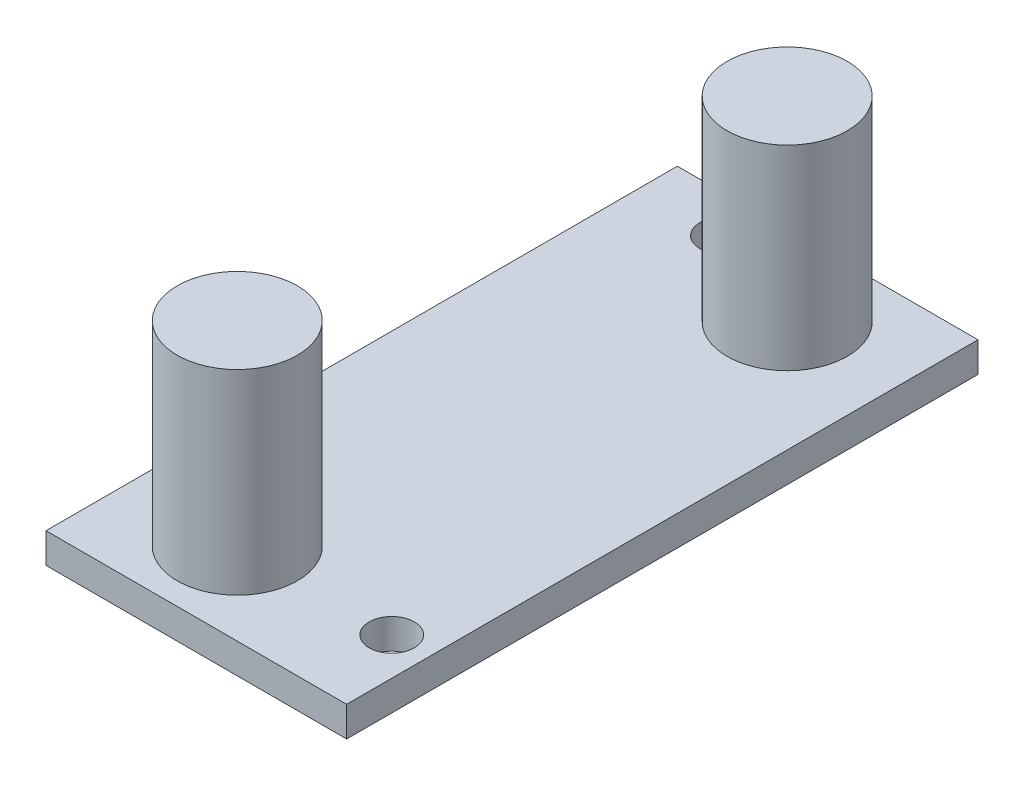
from build123d import *

# Parameters (mm, degrees)
SKETCH1_W           = 20
SKETCH1_H           = 42
BOSS_EXTRUDE1_DEPTH = 2
SKETCH2_R           = 4
BOSS_EXTRUDE2_DEPTH = 13
SKETCH3_R           = 1.5
CUT_EXTRUDE1_DEPTH  = 27.645825189


with BuildPart() as part:
    # Sketch1 → Boss-Extrude1 (new body)
    with BuildSketch(Plane(origin=(0, 0, 0), x_dir=(1, 0, 0), z_dir=(0, 1, 0))):
        Rectangle(SKETCH1_W, SKETCH1_H)
    extrude(amount=BOSS_EXTRUDE1_DEPTH)

    # Sketch2 → Boss-Extrude2 (add)
    with BuildSketch(Plane(origin=(0, 2, 0), x_dir=(1, 0, 0), z_dir=(0, 1, 0))):
        with Locations(Location((2.611238323, 15.696088344, 0), (0, 0, 90))):
            Circle(SKETCH2_R)
        with Locations(Location((-2.7484016, -15.525941045, 0), (0, 0, 90))):
            Circle(SKETCH2_R)
    extrude(amount=BOSS_EXTRUDE2_DEPTH)

    # Sketch3 → Cut-Extrude1 (cut, through all)
    with BuildSketch(Plane(origin=(0, 2, 0), x_dir=(1, 0, 0), z_dir=(0, 1, 0))):
        with Locations(Location((-4.5, 18.5, 0), (0, 0, 270))):
            Circle(SKETCH3_R)
        with Locations(Location((7.5, -15.5, 0), (0, 0, 270))):
            Circle(SKETCH3_R)
    extrude(amount=-CUT_EXTRUDE1_DEPTH, mode=Mode.SUBTRACT)


solid = part.part
